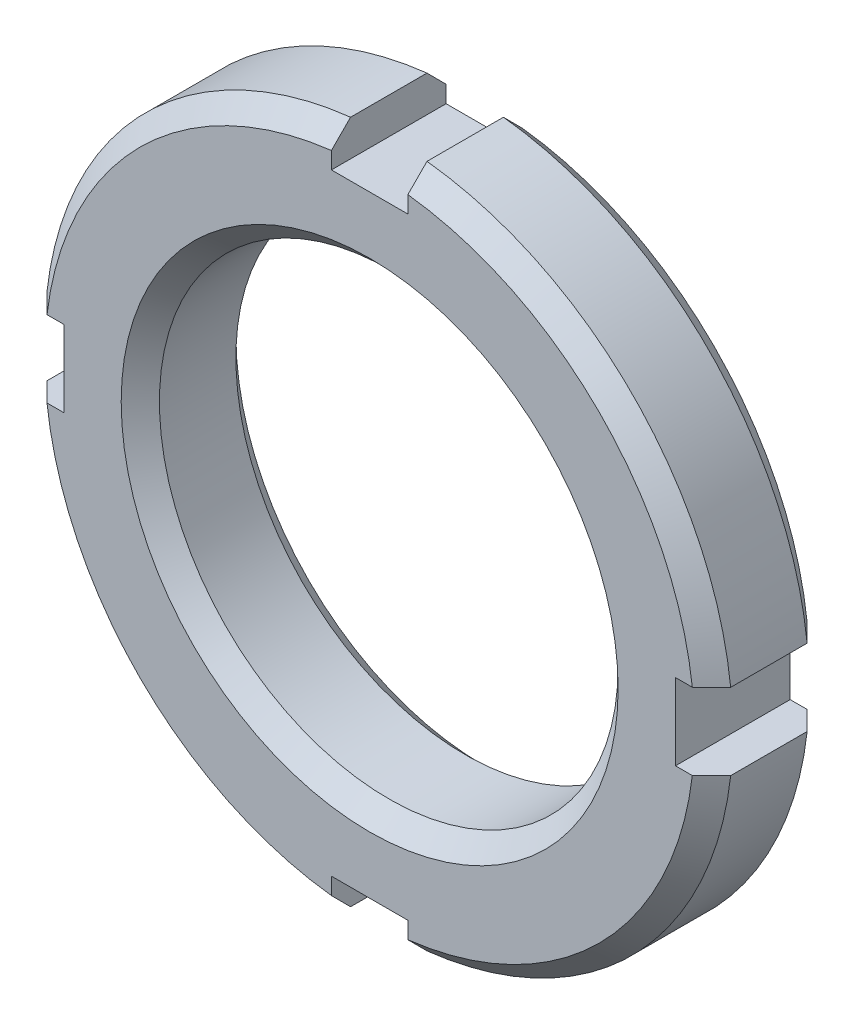
from build123d import *

# Parameters (mm, degrees)
SKETCH_1_R               = 9
SKETCH_1_R_2             = 6
EXTRUDE_1_DEPTH          = 3
CHAMFER_1_SIZE           = 0.5
SKETCH_2_W               = 2
SKETCH_2_H               = 2
CUT_EXTRUDE_1_DEPTH      = 14.076696831
PATTERN_CIRCULAR_1_COUNT = 4


with BuildPart() as part:
    # Эскиз1 → Бобышка-Вытянуть1 (new body)
    with BuildSketch(Plane.XY):
        Circle(SKETCH_1_R)
        Circle(SKETCH_1_R_2, mode=Mode.SUBTRACT)
    extrude(amount=EXTRUDE_1_DEPTH)

    # Фаска1
    chamfer_1_edges = [part.edges().sort_by_distance(p)[0] for p in [
        (-9, 0, 0),
        (-9, 0, 3),
        (-6, 0, 0),
        (-6, 0, 3),
    ]]
    chamfer(chamfer_1_edges, length=CHAMFER_1_SIZE)

    # Эскиз2 → Вырез-Вытянуть1 (cut, through all)
    with BuildSketch(Plane.XY.offset(3)):
        with Locations((0, 9)):
            Rectangle(SKETCH_2_W, SKETCH_2_H)
    cut_extrude_1 = extrude(amount=-CUT_EXTRUDE_1_DEPTH, mode=Mode.SUBTRACT)

    # Круговой массив1: Вырез-Вытянуть1 ×4 about axis
    pattern_circular_1_axis = Axis((0, 0, 0), (0, 0, 1))
    for i in range(1, PATTERN_CIRCULAR_1_COUNT):
        add(cut_extrude_1.rotate(pattern_circular_1_axis, i * 360 / PATTERN_CIRCULAR_1_COUNT), mode=Mode.SUBTRACT)


solid = part.part
